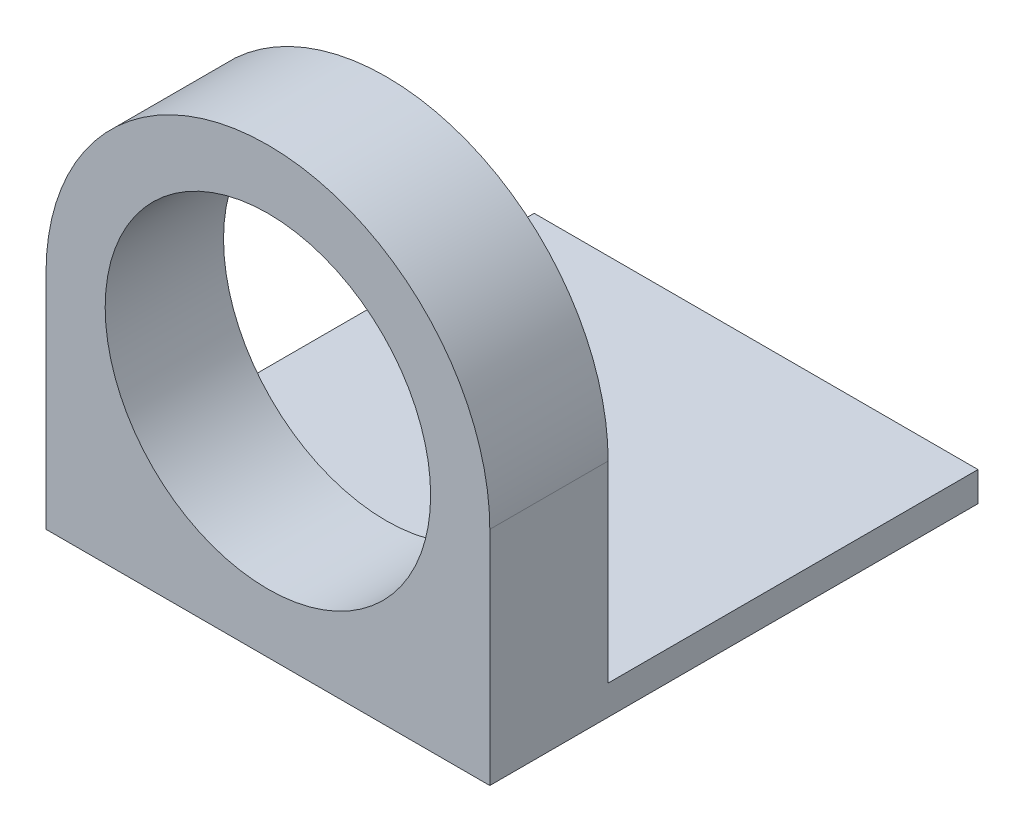
from build123d import *

# Parameters (mm, degrees)
SKETCH2_R           = 11
BOSS_EXTRUDE1_DEPTH = 8
SKETCH3_W           = 30
SKETCH3_H           = 2
BOSS_EXTRUDE2_DEPTH = 25


with BuildPart() as part:
    # Sketch2 → Boss-Extrude1 (new body)
    with BuildSketch(Plane.XY):
        with BuildLine():
            Line((0, -15), (-15, -15))
            Line((-15, -15), (-15, 0))
            ThreePointArc((-15, 0), (0, 15), (15, 0))
            Line((15, 0), (15, -15))
            Line((15, -15), (0, -15))
        make_face()
        Circle(SKETCH2_R, mode=Mode.SUBTRACT)
    extrude(amount=BOSS_EXTRUDE1_DEPTH)

    # Sketch3 → Boss-Extrude2 (add)
    with BuildSketch(Plane(origin=(0, 0, 0), x_dir=(-1, 0, 0), z_dir=(0, 0, -1))):
        with Locations((0, -14)):
            Rectangle(SKETCH3_W, SKETCH3_H)
    extrude(amount=BOSS_EXTRUDE2_DEPTH)


solid = part.part
